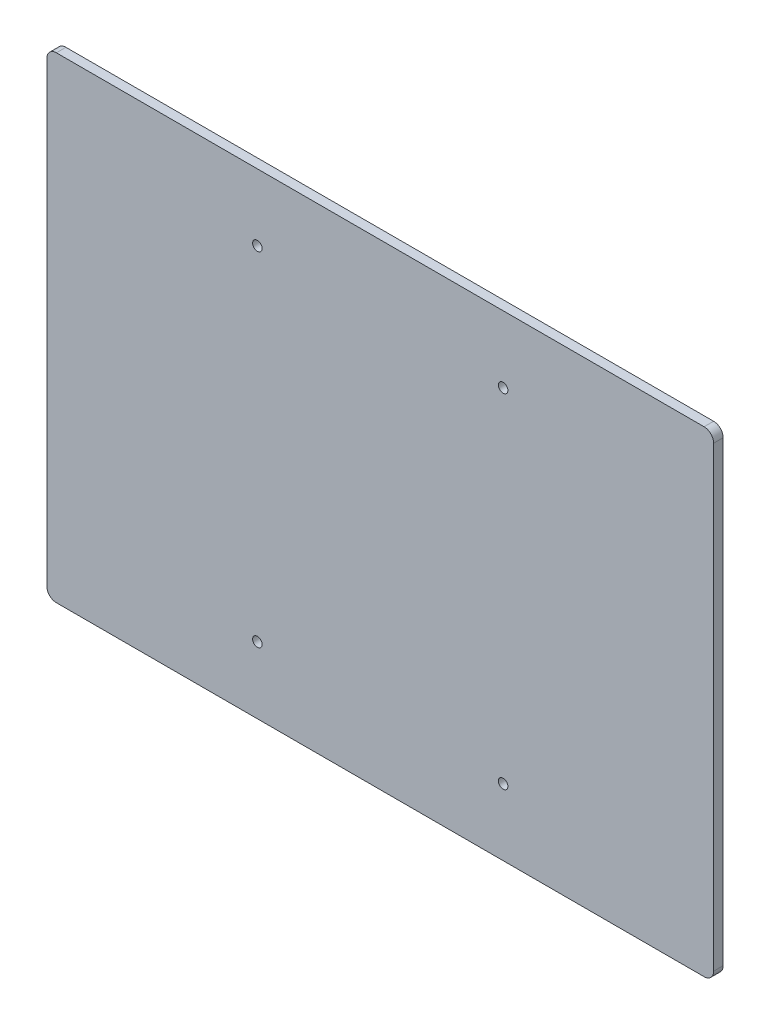
from build123d import *

# Parameters (mm, degrees)
ESQUISSE1_W             = 350
ESQUISSE1_H             = 250
BOSS_EXTRU_1_DEPTH      = 5
CONG_1_R                = 5
ESQUISSE2_R             = 2.5
ENL_V_MAT_EXTRU_1_DEPTH = 10


with BuildPart() as part:
    # Esquisse1 → Boss.-Extru.1 (new body)
    with BuildSketch(Plane.XY):
        with Locations((0, 125)):
            Rectangle(ESQUISSE1_W, ESQUISSE1_H)
    extrude(amount=BOSS_EXTRU_1_DEPTH)

    # Congé1
    cong_1_edges = [part.edges().sort_by_distance(p)[0] for p in [
        (-175, 250, 2.5),
        (175, 250, 2.5),
        (175, 0, 2.5),
        (-175, 0, 2.5),
    ]]
    fillet(cong_1_edges, radius=CONG_1_R)

    # Esquisse2 → Enlèv. mat.-Extru.1 (cut)
    with BuildSketch(Plane.XY):
        with Locations((64.5, 35)):
            Circle(ESQUISSE2_R)
        with Locations(Location((-64.5, 35, 0), (0, 0, 180))):
            Circle(ESQUISSE2_R)
        with Locations((-64.5, 215)):
            Circle(ESQUISSE2_R)
        with Locations(Location((64.5, 215, 0), (0, 0, 180))):
            Circle(ESQUISSE2_R)
    extrude(amount=ENL_V_MAT_EXTRU_1_DEPTH, mode=Mode.SUBTRACT)


solid = part.part
